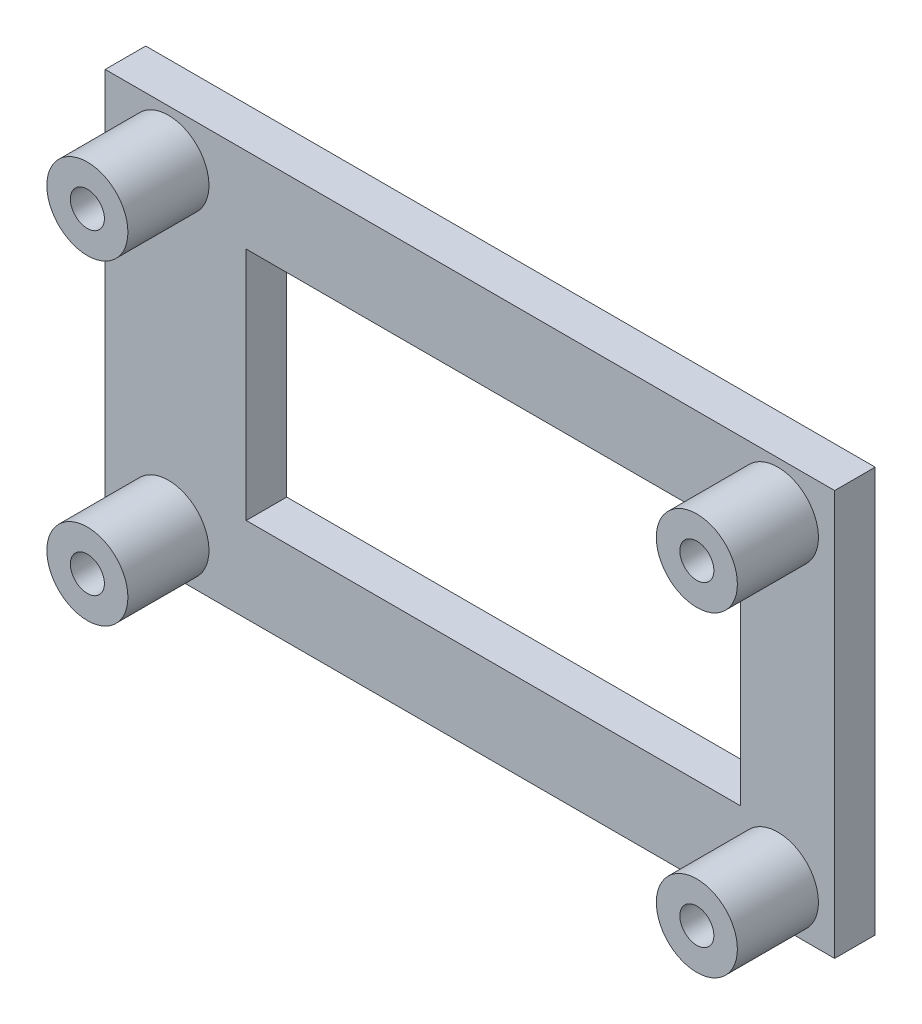
from build123d import *

# Parameters (mm, degrees)
SKETCH1_W           = 45
SKETCH1_H           = 25
BOSS_EXTRUDE1_DEPTH = 2.5
SKETCH1_3_R         = 2.5
BOSS_EXTRUDE2_DEPTH = 5
SKETCH2_R           = 1.05
CUT_EXTRUDE1_DEPTH  = 5
SKETCH3_W           = 30.5
SKETCH3_H           = 14.5
CUT_EXTRUDE2_DEPTH  = 2.5


with BuildPart() as part:
    # Sketch1 → Boss-Extrude1 (new body)
    with BuildSketch(Plane.XY):
        with Locations((22.5, 12.5)):
            Rectangle(SKETCH1_W, SKETCH1_H)
    extrude(amount=-BOSS_EXTRUDE1_DEPTH)

    # Sketch1<3> → Boss-Extrude2 (add)
    with BuildSketch(Plane.XY):
        with Locations(Location((3.9, 22, 0), (0, 0, 180))):
            Circle(SKETCH1_3_R)
        with Locations(Location((3.9, 2.5, 0), (0, 0, 270))):
            Circle(SKETCH1_3_R)
        with Locations(Location((41.5, 2.5, 0), (0, 0, 270))):
            Circle(SKETCH1_3_R)
        with Locations(Location((41.5, 22, 0), (0, 0, 180))):
            Circle(SKETCH1_3_R)
    extrude(amount=BOSS_EXTRUDE2_DEPTH)

    # Sketch2 → Cut-Extrude1 (cut)
    with BuildSketch(Plane.XY.offset(5)):
        with Locations((3.9, 22)):
            Circle(SKETCH2_R)
        with Locations((3.9, 2.5)):
            Circle(SKETCH2_R)
        with Locations((41.5, 22)):
            Circle(SKETCH2_R)
        with Locations((41.5, 2.5)):
            Circle(SKETCH2_R)
    extrude(amount=-CUT_EXTRUDE1_DEPTH, mode=Mode.SUBTRACT)

    # Sketch3 → Cut-Extrude2 (cut)
    with BuildSketch(Plane.XY):
        with Locations((23.95, 12.5)):
            Rectangle(SKETCH3_W, SKETCH3_H)
    extrude(amount=-CUT_EXTRUDE2_DEPTH, mode=Mode.SUBTRACT)


solid = part.part
